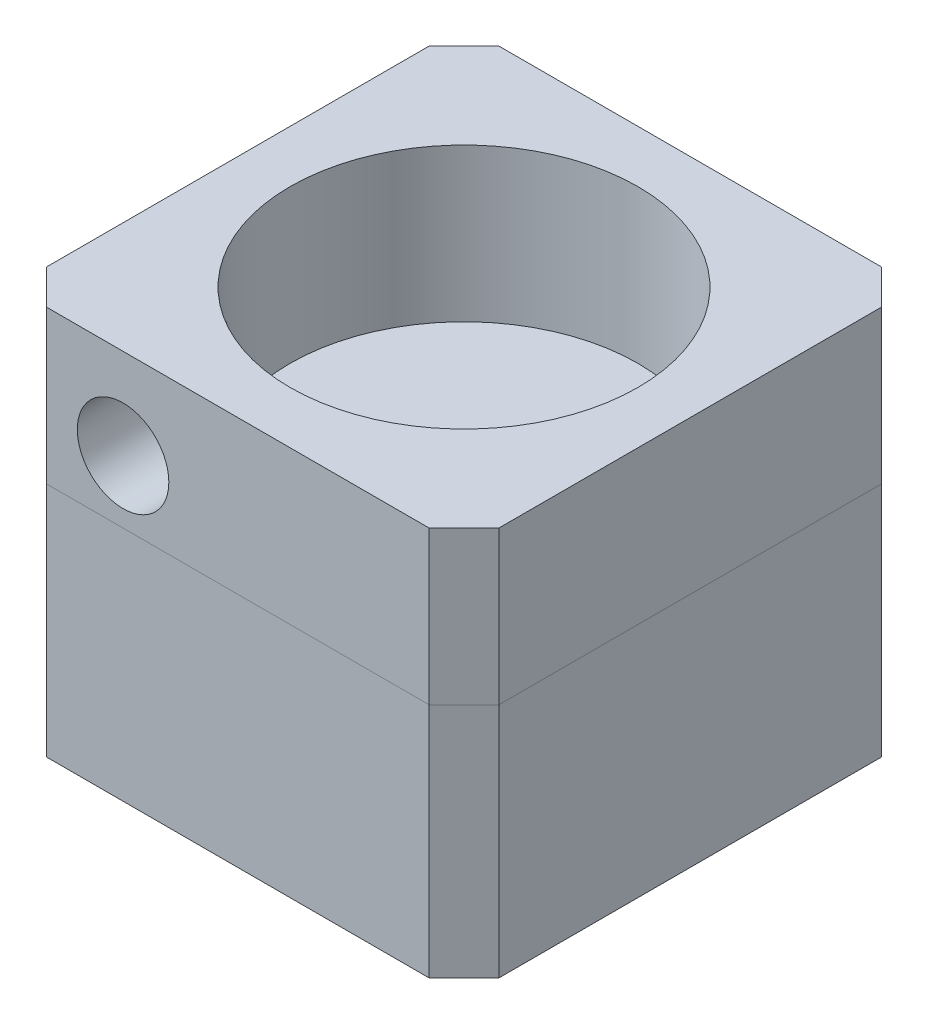
from build123d import *

# Parameters (mm, degrees)
SKETCH1_W                      = 65
SKETCH1_H                      = 65
BOSS_EXTRUDE1_DEPTH            = 34
CHAMFER1_SIZE                  = 5
BOSS_EXTRUDE2_DEPTH            = 22
SKETCH3_R                      = 6.5785
CUT_EXTRUDE1_DEPTH             = 20
CUT_EXTRUDE2_START             = 56
SKETCH1_3_R                    = 25
CUT_EXTRUDE2_DEPTH             = 22
M4X0_7_TAPPED_HOLE1_AT_2_COUNT = 2
M4X0_7_TAPPED_HOLE1_AT_2_PITCH = 37
M4X0_7_TAPPED_HOLE1_AT_3_COUNT = 2
M4X0_7_TAPPED_HOLE1_AT_3_PITCH = 53
M4X0_7_TAPPED_HOLE1_AT_4_COUNT = 2
M4X0_7_TAPPED_HOLE1_AT_4_PITCH = 64.637450445


with BuildPart() as part:
    # Sketch1 → Boss-Extrude1 (new body)
    with BuildSketch(Plane(origin=(0, 0, 0), x_dir=(1, 0, 0), z_dir=(0, 1, 0))):
        Rectangle(SKETCH1_W, SKETCH1_H)
    extrude(amount=BOSS_EXTRUDE1_DEPTH)

    # Chamfer1
    chamfer1_edges = [part.edges().sort_by_distance(p)[0] for p in [
        (-32.5, 17, 32.5),
        (-32.5, 17, -32.5),
        (32.5, 17, -32.5),
        (32.5, 17, 32.5),
    ]]
    chamfer(chamfer1_edges, length=CHAMFER1_SIZE)

    # Sketch5 → M4x0.7 Tapped Hole1 (revolve, cut)
    with BuildSketch(Plane(origin=(18.5, 0, -26.5), x_dir=(0, 0, -1), z_dir=(1, 0, 0))):
        Polygon((0, 0), (0, 11.091420021), (1.65, 10.1), (1.65, 0), align=None)
    m4x0_7_tapped_hole1 = revolve(axis=Axis((18.5, -6.35, -26.5), (0, 1, 0)), mode=Mode.SUBTRACT)

    # M4x0.7 Tapped Hole1 at 2: M4x0.7 Tapped Hole1 ×2
    with Locations(*[(-i * M4X0_7_TAPPED_HOLE1_AT_2_PITCH, 0, 0) for i in range(1, M4X0_7_TAPPED_HOLE1_AT_2_COUNT)]):
        add(m4x0_7_tapped_hole1, mode=Mode.SUBTRACT)

    # M4x0.7 Tapped Hole1 at 3: M4x0.7 Tapped Hole1 ×2
    with Locations(*[(0, 0, i * M4X0_7_TAPPED_HOLE1_AT_3_PITCH) for i in range(1, M4X0_7_TAPPED_HOLE1_AT_3_COUNT)]):
        add(m4x0_7_tapped_hole1, mode=Mode.SUBTRACT)

    # M4x0.7 Tapped Hole1 at 4: M4x0.7 Tapped Hole1 ×2
    with Locations(*[Vector(-0.5724235678450125, 0, 0.8199580836698828) * (i * M4X0_7_TAPPED_HOLE1_AT_4_PITCH) for i in range(1, M4X0_7_TAPPED_HOLE1_AT_4_COUNT)]):
        add(m4x0_7_tapped_hole1, mode=Mode.SUBTRACT)


with BuildPart() as body_2:
    # Sketch2 → Boss-Extrude2 (new body)
    with BuildSketch(Plane(origin=(0, 34, 0), x_dir=(1, 0, 0), z_dir=(0, 1, 0))):
        Polygon((27.5, 32.5), (-27.5, 32.5), (-32.5, 27.5), (-32.5, -27.5), (-27.5, -32.5), (27.5, -32.5), (32.5, -27.5), (32.5, 27.5), align=None)
    extrude(amount=BOSS_EXTRUDE2_DEPTH)

    # Sketch3 → Cut-Extrude1 (cut)
    with BuildSketch(Plane.XY.offset(32.5)):
        with Locations((-16.5, 43)):
            Circle(SKETCH3_R)
    extrude(amount=-CUT_EXTRUDE1_DEPTH, mode=Mode.SUBTRACT)

    # Sketch1<3> → Cut-Extrude2 (cut)
    with BuildSketch(Plane(origin=(0, 0, 0), x_dir=(1, 0, 0), z_dir=(0, 1, 0)).offset(CUT_EXTRUDE2_START)):
        with Locations(Location((0, 0, 0), (0, 0, 270))):
            Circle(SKETCH1_3_R)
    extrude(amount=-CUT_EXTRUDE2_DEPTH, mode=Mode.SUBTRACT)


solid = Compound([part.part, body_2.part])
